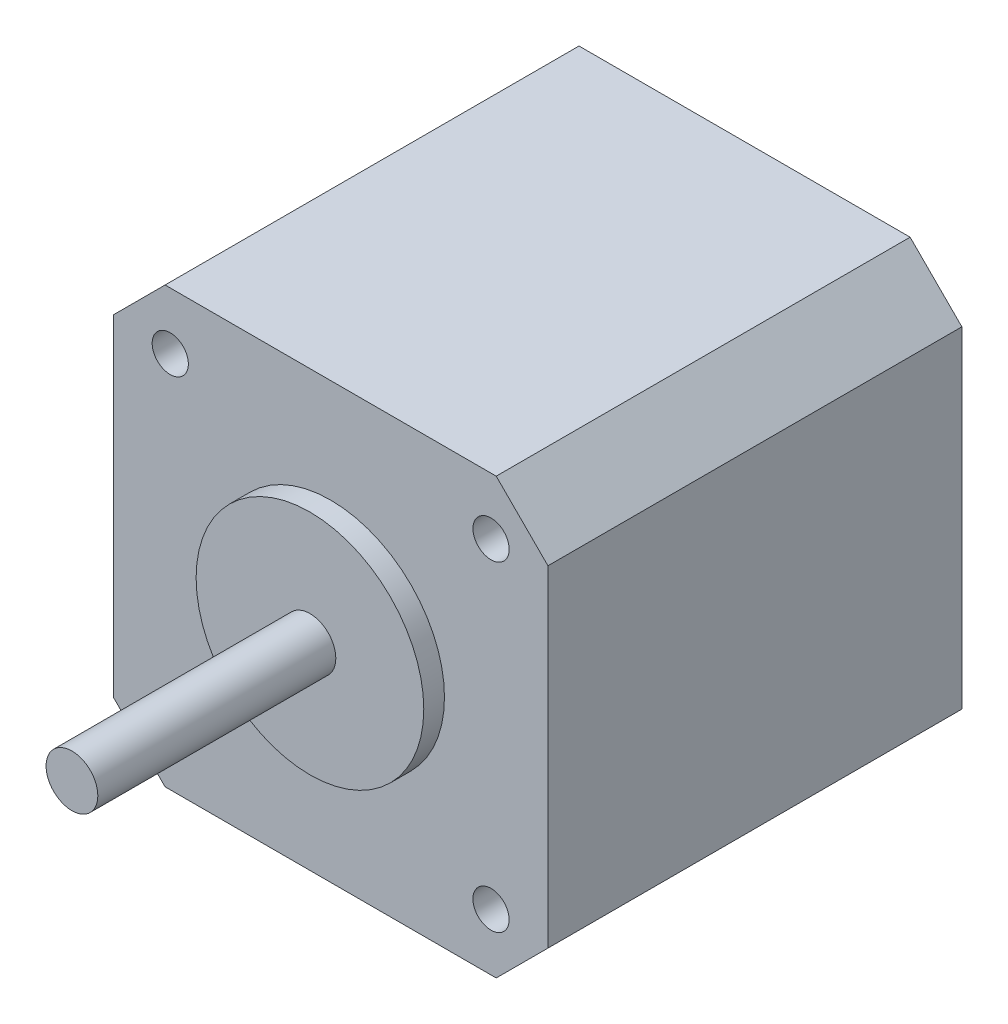
from build123d import *

# Parameters (mm, degrees)
SKETCH_1_W          = 42
SKETCH_1_H          = 42
EXTRUDE_1_DEPTH     = 40
CHAMFER_1_SIZE      = 5
SKETCH_2_R          = 11
EXTRUDE_2_DEPTH     = 2
SKETCH_3_R          = 2.5
EXTRUDE_3_DEPTH     = 23
SKETCH_4_R          = 1.75
CUT_EXTRUDE_1_DEPTH = 3


with BuildPart() as part:
    # 草圖1 → 填料-伸長1 (new body)
    with BuildSketch(Plane.XY):
        Rectangle(SKETCH_1_W, SKETCH_1_H)
    extrude(amount=EXTRUDE_1_DEPTH)

    # 導角1
    chamfer_1_edges = [part.edges().sort_by_distance(p)[0] for p in [
        (-21, 21, 20),
        (21, 21, 20),
        (21, -21, 20),
        (-21, -21, 20),
    ]]
    chamfer(chamfer_1_edges, length=CHAMFER_1_SIZE)

    # 草圖2 → 填料-伸長2 (add)
    with BuildSketch(Plane.XY.offset(40)):
        Circle(SKETCH_2_R)
    extrude(amount=EXTRUDE_2_DEPTH)

    # 草圖3 → 填料-伸長3 (add)
    with BuildSketch(Plane.XY.offset(42)):
        Circle(SKETCH_3_R)
    extrude(amount=EXTRUDE_3_DEPTH)

    # 草圖4 → 除料-伸長1 (cut)
    with BuildSketch(Plane.XY.offset(40)):
        with Locations((-15.5, 15.5)):
            Circle(SKETCH_4_R)
        with Locations(Location((-15.5, -15.5, 0), (0, 0, 180))):
            Circle(SKETCH_4_R)
        with Locations((15.5, -15.5)):
            Circle(SKETCH_4_R)
        with Locations(Location((15.5, 15.5, 0), (0, 0, 180))):
            Circle(SKETCH_4_R)
    extrude(amount=-CUT_EXTRUDE_1_DEPTH, mode=Mode.SUBTRACT)


solid = part.part
